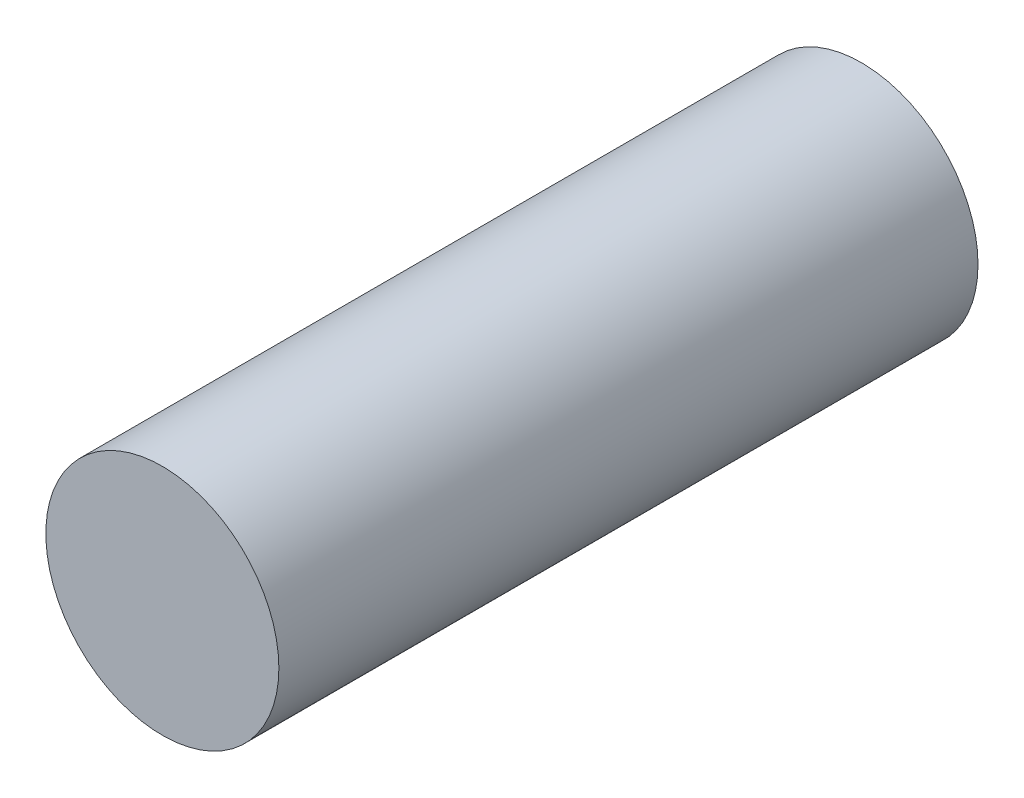
from build123d import *

# Parameters (mm, degrees)
SKETCH1_R           = 12.5
BOSS_EXTRUDE1_DEPTH = 75


with BuildPart() as part:
    # Sketch1 → Boss-Extrude1 (new body)
    with BuildSketch(Plane.XY):
        Circle(SKETCH1_R)
    extrude(amount=BOSS_EXTRUDE1_DEPTH)


solid = part.part
